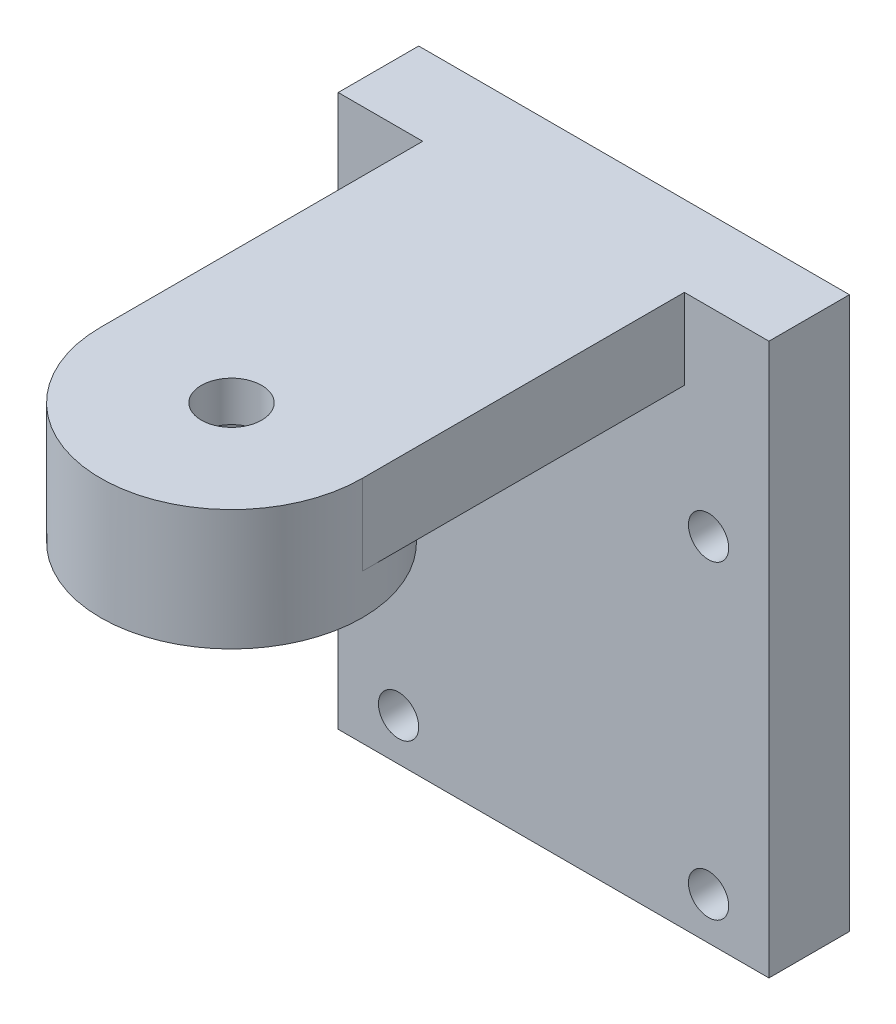
from build123d import *

# Parameters (mm, degrees)
SKETCH_2_R           = 6.5
EXTRUDE_1_DEPTH      = 6
CUT_EXTRUDE_1_DEPTH  = 4
SKETCH_3_R           = 1.5
CUT_EXTRUDE_2_DEPTH  = 4
EXTRUDE_START        = -4
EXTRUDE_2_DEPTH      = 4
EXTRUDE_6_DEPTH      = 4
SKETCH_17_R          = 1
CUT_EXTRUDE_11_DEPTH = 4


with BuildPart() as part:
    # 草图2 → 凸台-拉伸1 (new body)
    with BuildSketch(Plane(origin=(0, 0, 0), x_dir=(1, 0, 0), z_dir=(0, 1, 0))):
        with Locations(Location((0, 0, 0), (0, 0, 270))):
            Circle(SKETCH_2_R)
    extrude(amount=EXTRUDE_1_DEPTH)

    # 草图1 → 切除-拉伸1 (cut)
    with BuildSketch(Plane(origin=(0, 0, 0), x_dir=(1, 0, 0), z_dir=(0, 1, 0))):
        Polygon((5, 0), (2.5, 4.330127019), (-2.5, 4.330127019), (-5, 0), (-2.5, -4.330127019), (2.5, -4.330127019), align=None)
    extrude(amount=CUT_EXTRUDE_1_DEPTH, mode=Mode.SUBTRACT)

    # 草图3 → 切除-拉伸2 (cut)
    with BuildSketch(Plane(origin=(0, 6, 0), x_dir=(1, 0, 0), z_dir=(0, 1, 0))):
        with Locations(Location((0, 0, 0), (0, 0, 270))):
            Circle(SKETCH_3_R)
    extrude(amount=-CUT_EXTRUDE_2_DEPTH, mode=Mode.SUBTRACT)

    # 草图4 → 凸台-拉伸2 (add)
    with BuildSketch(Plane(origin=(0, 6, 0), x_dir=(1, 0, 0), z_dir=(0, 1, 0)).offset(EXTRUDE_START)):
        with BuildLine():
            Line((6.5, 0), (6.5, 20))
            Line((6.5, 20), (4, 20))
            Line((4, 20), (-4, 20))
            Line((-4, 20), (-6.5, 20))
            Line((-6.5, 20), (-6.5, 0))
            ThreePointArc((-6.5, 0), (0, 6.5), (6.5, 0))
        make_face()
    extrude(amount=EXTRUDE_2_DEPTH)

    # 草图6 → 凸台-拉伸6 (add)
    with BuildSketch(Plane(origin=(0, 0, -20), x_dir=(-1, 0, 0), z_dir=(0, 0, -1))):
        Polygon((10.7, -14.240758791), (10.7, 6), (-10.7, 6), (-10.7, -21.4), (10.7, -21.4), align=None)
    extrude(amount=-EXTRUDE_6_DEPTH)

    # 草图17 → 切除-拉伸11 (cut)
    with BuildSketch(Plane.XY.offset(-16)):
        with Locations((-7.7, -19.3)):
            Circle(SKETCH_17_R)
        with Locations((7.7, -19.3)):
            Circle(SKETCH_17_R)
        with Locations((7.7, -3.9)):
            Circle(SKETCH_17_R)
        with Locations((-7.7, -3.9)):
            Circle(SKETCH_17_R)
    extrude(amount=-CUT_EXTRUDE_11_DEPTH, mode=Mode.SUBTRACT)


solid = part.part
